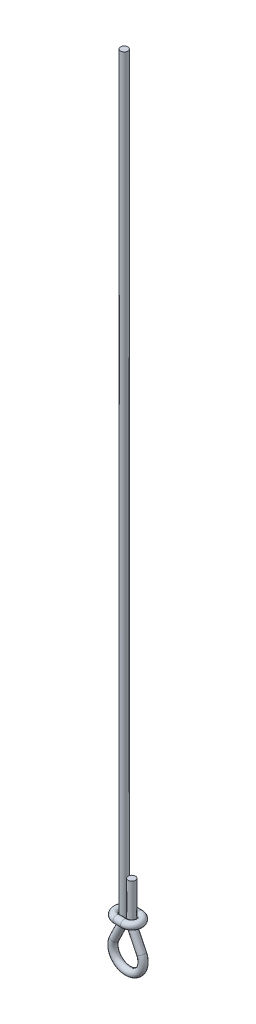
from build123d import *

# Parameters (mm, degrees)
SWEEP1_PROFILE_R = 0.725
SWEEP2_PROFILE_R = 0.725


with BuildPart() as part:
    # Sweep1: sweep along a path in Sketch1
    with BuildLine(Plane.XY) as sweep1_path:
        Line((0, 150), (0, 0))
        Line((0, 0), (-1.947336329, -4))
        ThreePointArc((-1.947336329, -4), (0.75, -8.313155256), (3.447336329, -4))
        Line((3.447336329, -4), (1.5, 0))
        Line((1.5, 0), (1.5, 8))
    # Sweep1 profile (on start of the path) → Sweep1 (sweep)
    with BuildSketch(Plane(origin=(0, 150, 0), x_dir=(0, 0, -1), z_dir=(0, -1, 0))):
        Circle(SWEEP1_PROFILE_R)
    sweep(path=sweep1_path.line, transition=Transition.RIGHT)


with BuildPart() as body_2:
    # Sweep2: sweep along a path in Sketch18
    with BuildLine(Plane(origin=(0, 1, 0), x_dir=(1, 0, 0), z_dir=(0, 1, 0))) as sweep2_path:
        Line((0, 1.5), (1.5, 1.5))
        ThreePointArc((1.5, 1.5), (3, 0), (1.5, -1.5))
        Line((1.5, -1.5), (0, -1.5))
        ThreePointArc((0, -1.5), (-1.5, 0), (0, 1.5))
    # Sweep2 profile (on start of the path) → Sweep2 (sweep)
    with BuildSketch(Plane(origin=(0, 1, -1.5), x_dir=(0, 0, 1), z_dir=(1, 0, 0))):
        Circle(SWEEP2_PROFILE_R)
    sweep(path=sweep2_path.line)


solid = Compound([part.part, body_2.part])
